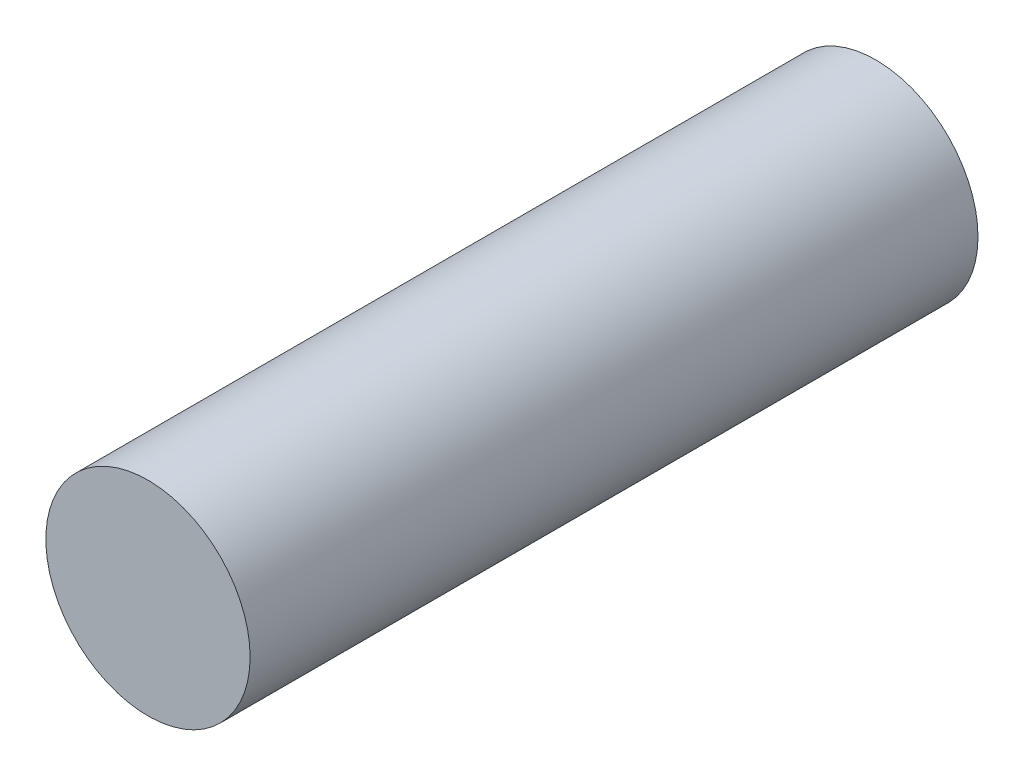
from build123d import *

# Parameters (mm, degrees)
SKETCH1_R           = 9
BOSS_EXTRUDE1_DEPTH = 64.14


with BuildPart() as part:
    # Sketch1 → Boss-Extrude1 (new body)
    with BuildSketch(Plane(origin=(0, 0, 0), x_dir=(0, 1, 0), z_dir=(0, 0, 1))):
        with Locations(Location((0, 0, 0), (0, 0, 270))):
            Circle(SKETCH1_R)
    extrude(amount=BOSS_EXTRUDE1_DEPTH)


solid = part.part
